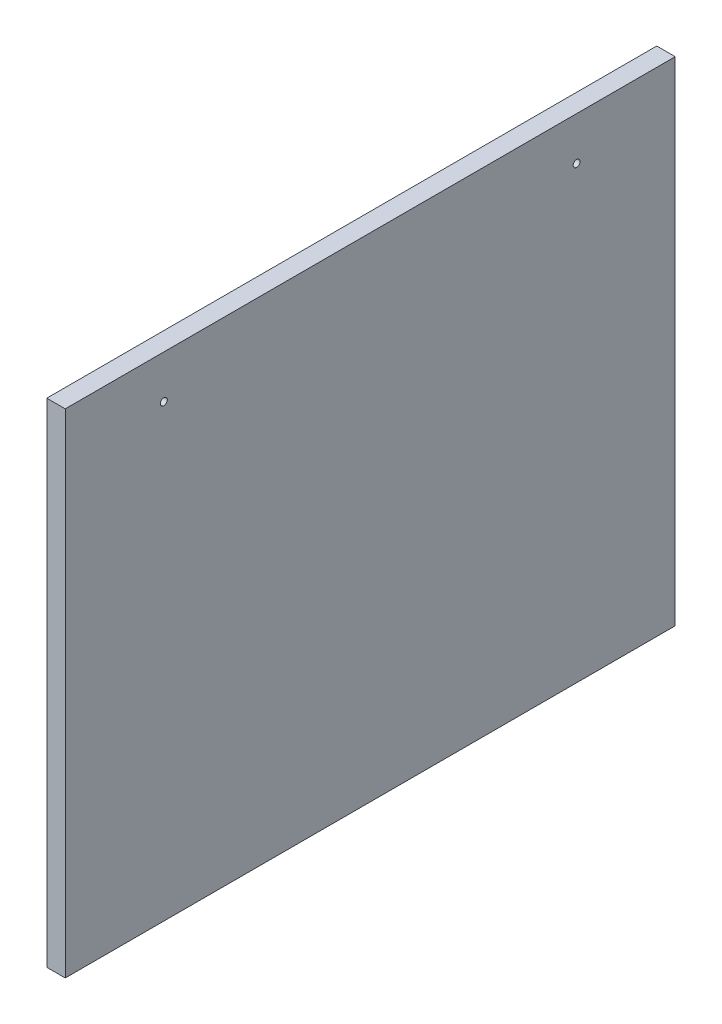
from build123d import *

# Parameters (mm, degrees)
SKETCH1_W           = 628.65
SKETCH1_H           = 508
SKETCH1_R           = 3.571875
BOSS_EXTRUDE1_DEPTH = 19.05


with BuildPart() as part:
    # Sketch1 → Boss-Extrude1 (new body)
    with BuildSketch(Plane(origin=(0, 0, 0), x_dir=(0, 0, -1), z_dir=(1, 0, 0))):
        with Locations((314.325, 254)):
            Rectangle(SKETCH1_W, SKETCH1_H)
        with Locations(Location((101.6, 463.55, 0), (0, 0, 180))):
            Circle(SKETCH1_R, mode=Mode.SUBTRACT)
        with Locations(Location((527.05, 463.55, 0), (0, 0, 180))):
            Circle(SKETCH1_R, mode=Mode.SUBTRACT)
    extrude(amount=BOSS_EXTRUDE1_DEPTH)


solid = part.part
